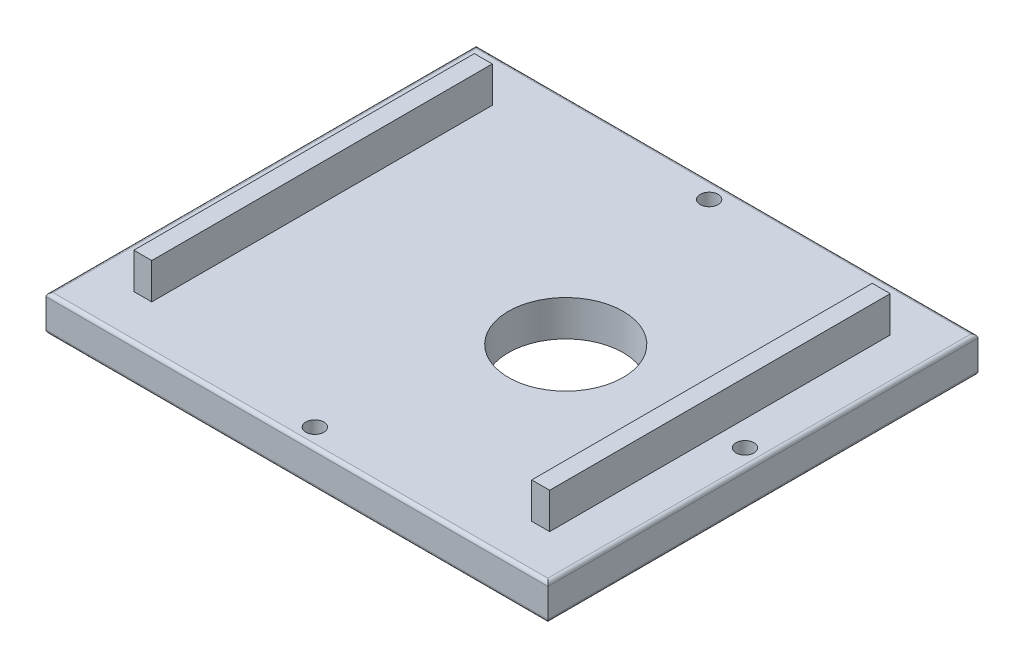
from build123d import *

# Parameters (mm, degrees)
SKETCH1_W                   = 140
SKETCH1_H                   = 120
LID_EXTRUDE_DEPTH           = 10
SKETCH3_W                   = 5
SKETCH3_H                   = 95
LOCATION_BAR_EXTRUDE_DEPTH  = 10
M6_TAPPED_HOLE1_D           = 5
M6_TAPPED_HOLE1_CSINK_D     = 6.05
M6_TAPPED_HOLE1_CSINK_ANGLE = 90
MOTOR_HOLE_CUT_REACH        = 96.34
SKETCH6_R                   = 16
FILLET2_R                   = 1


with BuildPart() as part:
    # Sketch1 → LID_EXTRUDE (new body)
    with BuildSketch(Plane(origin=(0, 0, 0), x_dir=(1, 0, 0), z_dir=(0, 1, 0))):
        Rectangle(SKETCH1_W, SKETCH1_H)
    extrude(amount=LID_EXTRUDE_DEPTH)

    # Sketch3 → LOCATION_BAR_EXTRUDE (add)
    with BuildSketch(Plane(origin=(0, 10, 0), x_dir=(1, 0, 0), z_dir=(0, 1, 0))):
        with Locations((-55.5, 0)):
            Rectangle(SKETCH3_W, SKETCH3_H)
        with Locations((55.5, 0)):
            Rectangle(SKETCH3_W, SKETCH3_H)
    extrude(amount=LOCATION_BAR_EXTRUDE_DEPTH)

    # M6 Tapped Hole1 (through all)
    with Locations(Plane(origin=(0, 0, 55), x_dir=(0, 0, -1), z_dir=(0, -1, 0))):
        with Locations((0, 0), (55, -65)):
            m6_tapped_hole1 = CounterSinkHole(M6_TAPPED_HOLE1_D / 2, M6_TAPPED_HOLE1_CSINK_D / 2, counter_sink_angle=M6_TAPPED_HOLE1_CSINK_ANGLE)

    # Mirror1: M6 Tapped Hole1 across plane
    add(m6_tapped_hole1.mirror(Plane(origin=(0, 0, 0), x_dir=(0, 0, 1), z_dir=(1, 0, 0))), mode=Mode.SUBTRACT)

    # Mirror1 at the second plane: M6 Tapped Hole1 across plane
    add(m6_tapped_hole1.mirror(Plane.XY), mode=Mode.SUBTRACT)

    # Sketch6 → MOTOR_HOLE_CUT (cut, up to next)
    with BuildSketch(Plane.XZ, mode=Mode.PRIVATE) as motor_hole_cut_sk1:
        with Locations(Location((15, 0, 0), (0, 0, 270))):
            Circle(SKETCH6_R)
    motor_hole_cut_tool1 = extrude(motor_hole_cut_sk1.sketch, amount=-MOTOR_HOLE_CUT_REACH, mode=Mode.PRIVATE) & part.part
    add(motor_hole_cut_tool1.solids().sort_by_distance((15, 0, 0))[0], mode=Mode.SUBTRACT)

    # Fillet2
    fillet2_edges = [part.edges().sort_by_distance(p)[0] for p in [
        (70, 10, 0),
        (0, 10, -60),
        (-70, 10, 0),
        (0, 0, -60),
        (70, 0, 0),
        (0, 0, 60),
        (-70, 0, 0),
        (0, 10, 60),
    ]]
    fillet(fillet2_edges, radius=FILLET2_R)


solid = part.part
